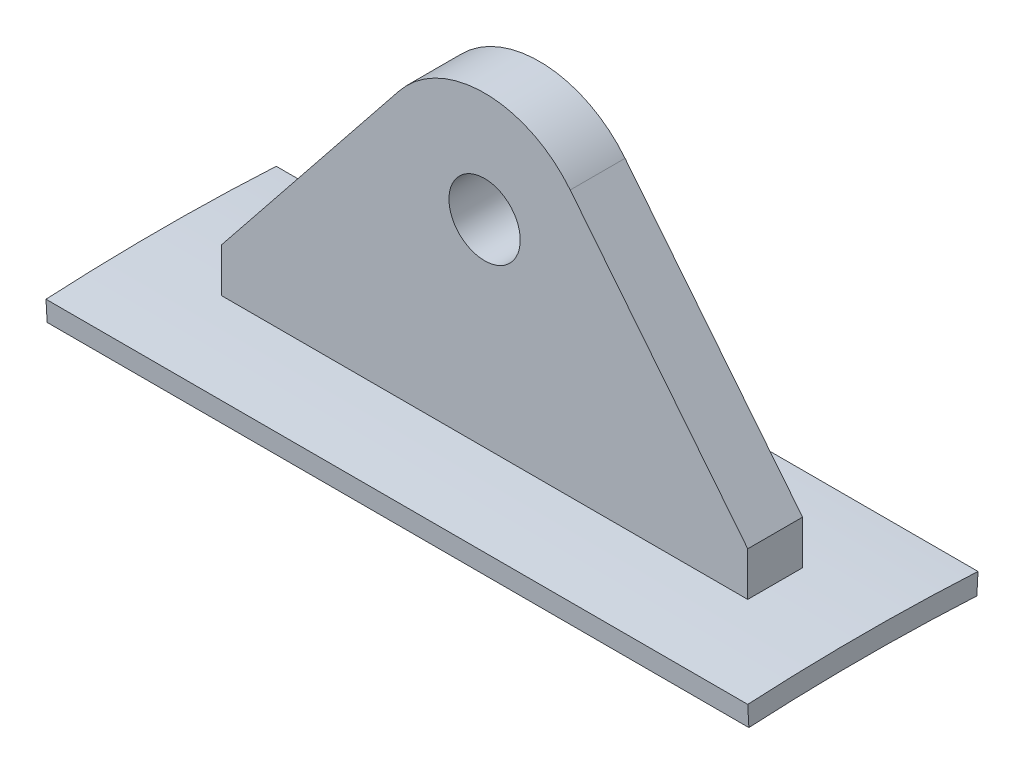
from build123d import *

# Parameters (mm, degrees)
SKETCH1_R           = 20.6375
BOSS_EXTRUDE4_DEPTH = 31.75
BOSS_EXTRUDE6_DEPTH = 203.2


with BuildPart() as part:
    # Sketch1 → Boss-Extrude4 (new body)
    with BuildSketch(Plane.XY):
        with BuildLine():
            Line((-152.4, 0), (152.4, 0))
            Line((152.4, 0), (152.4, 25.4))
            Line((152.4, 25.4), (49.592634616, 153.958802199))
            ThreePointArc((49.592634616, 153.958802199), (0, 177.8), (-49.592634616, 153.958802199))
            Line((-49.592634616, 153.958802199), (-152.4, 25.4))
            Line((-152.4, 25.4), (-152.4, 0))
        make_face()
        with Locations((0, 114.3)):
            Circle(SKETCH1_R, mode=Mode.SUBTRACT)
    extrude(amount=BOSS_EXTRUDE4_DEPTH)


with BuildPart() as body_2:
    # Sketch5 → Boss-Extrude6 (new, symmetric)
    with BuildSketch(Plane(origin=(0, 0, 0), x_dir=(0, 0, -1), z_dir=(1, 0, 0))):
        with BuildLine():
            Line((-82.55, -1.830524376), (-81.891589862, -13.812448099))
            ThreePointArc((-81.891589862, -13.812448099), (-15.875, -12), (50.141589862, -13.812448099))
            Line((50.141589862, -13.812448099), (50.8, -1.830524376))
            ThreePointArc((50.8, -1.830524376), (-15.875, 0), (-82.55, -1.830524376))
        make_face()
    extrude(amount=BOSS_EXTRUDE6_DEPTH, both=True)


solid = Compound([part.part, body_2.part])
